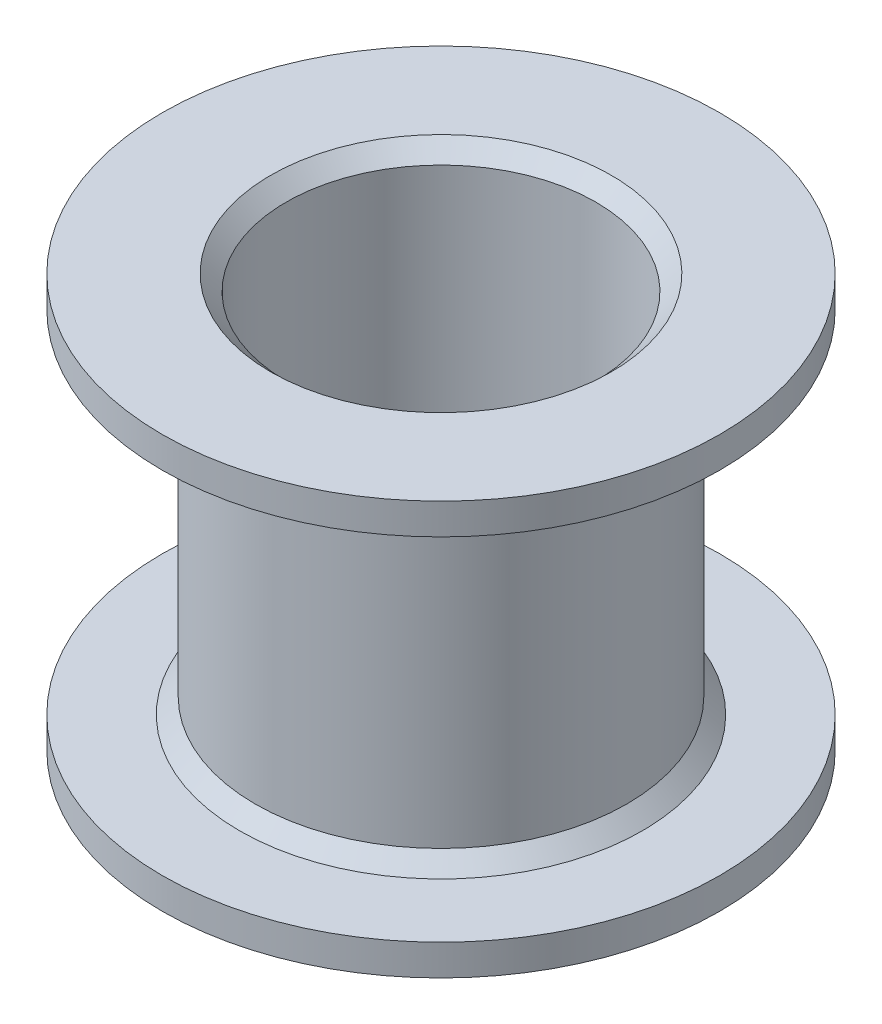
from build123d import *

# Parameters (mm, degrees)
SKETCH1_R           = 1.8
SKETCH1_R_2         = 1.5
BOSS_EXTRUDE1_DEPTH = 1.7
SKETCH2_R           = 2.7
SKETCH2_R_2         = 1.5
BOSS_EXTRUDE2_DEPTH = 0.3
CHAMFER1_SIZE       = 0.15
CHAMFER2_SIZE       = 0.15


with BuildPart() as part:
    # Sketch1 → Boss-Extrude1 (new body)
    with BuildSketch(Plane(origin=(0, 0, 0), x_dir=(1, 0, 0), z_dir=(0, 1, 0))):
        with Locations(Location((0, 0, 0), (0, 0, 270))):
            Circle(SKETCH1_R)
        with Locations(Location((0, 0, 0), (0, 0, 270))):
            Circle(SKETCH1_R_2, mode=Mode.SUBTRACT)
    extrude(amount=BOSS_EXTRUDE1_DEPTH)

    # Sketch2 → Boss-Extrude2 (add)
    with BuildSketch(Plane(origin=(0, 1.7, 0), x_dir=(1, 0, 0), z_dir=(0, 1, 0))):
        with Locations(Location((0, 0, 0), (0, 0, 270))):
            Circle(SKETCH2_R)
        with Locations(Location((0, 0, 0), (0, 0, 270))):
            Circle(SKETCH2_R_2, mode=Mode.SUBTRACT)
    extrude(amount=BOSS_EXTRUDE2_DEPTH)

    # Chamfer1
    chamfer1_edges = [part.edges().sort_by_distance(p)[0] for p in [
        (0, 1.7, -1.8),
    ]]
    chamfer(chamfer1_edges, length=CHAMFER1_SIZE)

    # Chamfer2
    chamfer2_edges = [part.edges().sort_by_distance(p)[0] for p in [
        (0, 2, -1.5),
    ]]
    chamfer(chamfer2_edges, length=CHAMFER2_SIZE)

    # Mirror1: part across plane


with BuildPart() as part_1:
    add(part.part)
    add(part.part.mirror(Plane.ZX))


solid = part_1.part
